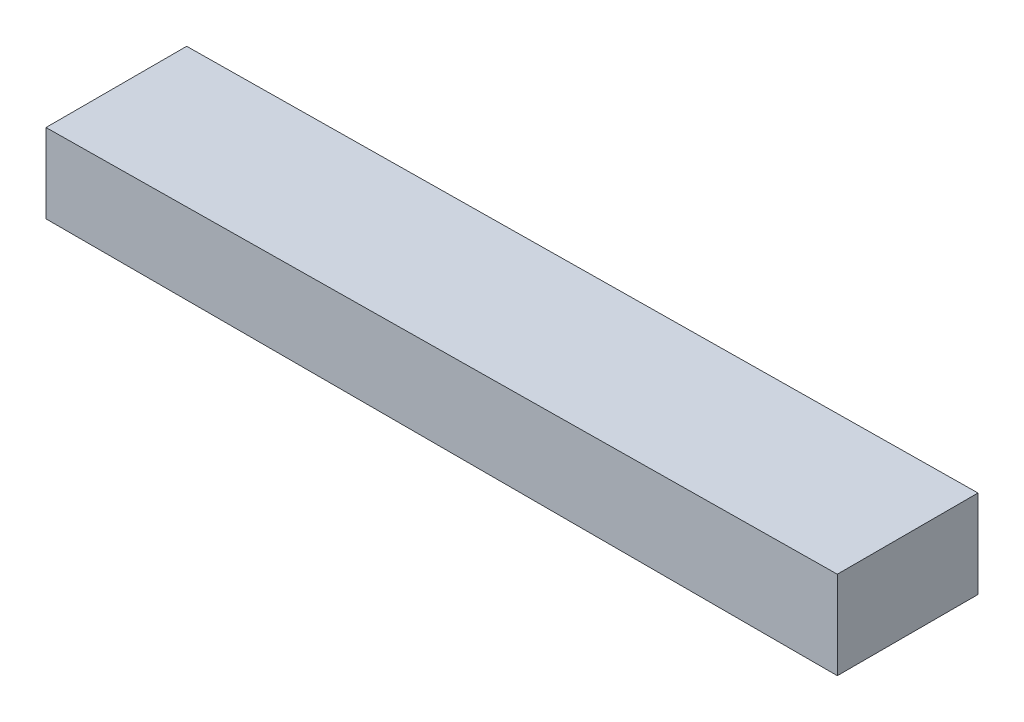
from build123d import *

# Parameters (mm, degrees)
BOSS_EXTRUDE1_DEPTH = 16


with BuildPart() as part:
    # Sketch1 → Boss-Extrude1 (new body)
    with BuildSketch(Plane.XY):
        Polygon((0, 0), (90, 0), (90, 10), (0, 9), align=None)
    extrude(amount=BOSS_EXTRUDE1_DEPTH)


solid = part.part
